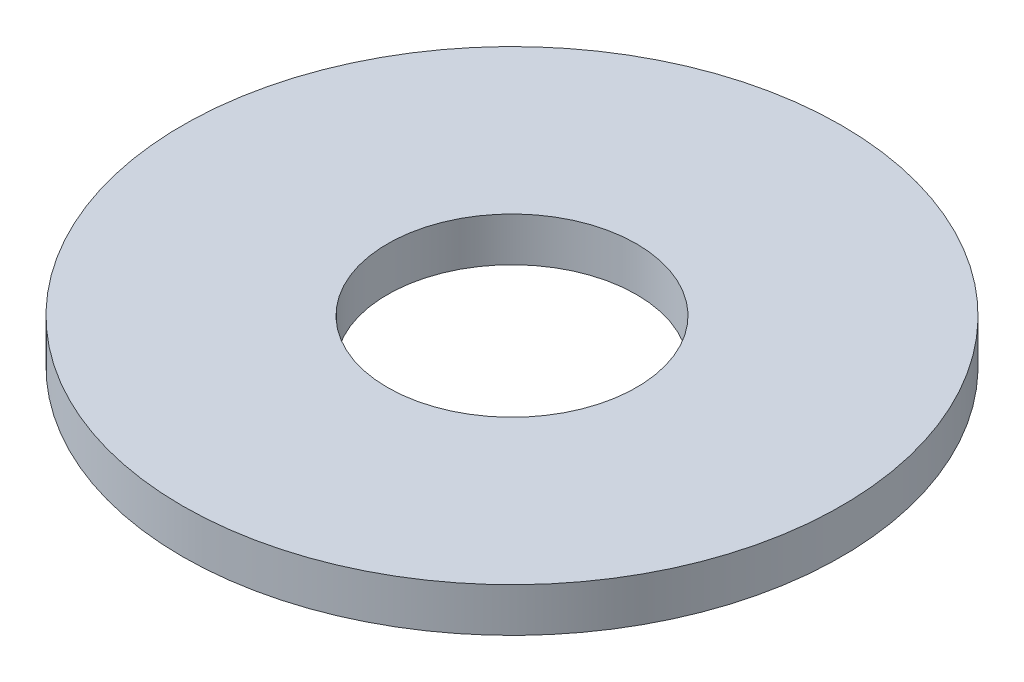
from build123d import *

# Parameters (mm, degrees)
SKETCH_1_R      = 11.25
SKETCH_1_R_2    = 4.25
EXTRUDE_1_DEPTH = 1.5


with BuildPart() as part:
    # 草圖1 → 填料-伸長1 (new body)
    with BuildSketch(Plane(origin=(0, 0, 0), x_dir=(1, 0, 0), z_dir=(0, 1, 0))):
        with Locations(Location((0, 0, 0), (0, 0, 270))):
            Circle(SKETCH_1_R)
        with Locations(Location((0, 0, 0), (0, 0, 270))):
            Circle(SKETCH_1_R_2, mode=Mode.SUBTRACT)
    extrude(amount=EXTRUDE_1_DEPTH)


solid = part.part
